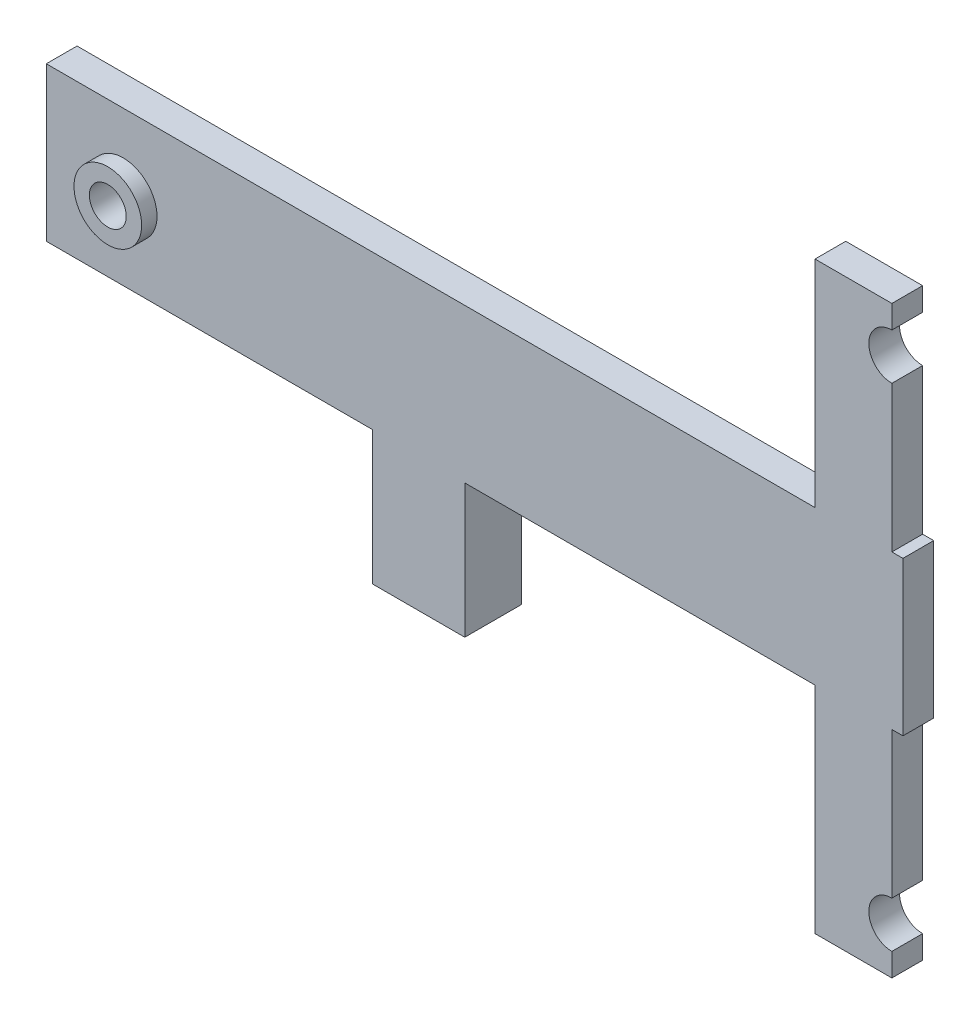
from build123d import *

# Parameters (mm, degrees)
SKETCH1_R                = 0.254
SKETCH1_R_2              = 1.2
BOSS_EXTRUDE1_DEPTH      = 1
SKETCH2_R                = 2.2
SKETCH2_R_2              = 1.2
BOSS_EXTRUDE2_DEPTH      = 2
BOSS_EXTRUDE3_DEPTH      = 1.7018
BOSS_EXTRUDE3_DEPTH_BACK = 2
SKETCH5_R                = 1
CUT_EXTRUDE3_DEPTH       = 2


with BuildPart() as part:
    # Sketch1 → Boss-Extrude1 (new, symmetric)
    with BuildSketch(Plane.XY):
        with BuildLine():
            Line((-5, 5), (-5, -5))
            Line((-5, -5), (45, -5))
            Line((45, -5), (45, -19))
            Line((45, -19), (50, -19))
            Line((50, -19), (50, -17.5))
            ThreePointArc((50, -17.5), (48.5, -16), (50, -14.5))
            Line((50, -14.5), (50, -5))
            Line((50, -5), (50.72, -5))
            Line((50.72, -5), (50.72, 0))
            Line((50.72, 0), (50.72, 5))
            Line((50.72, 5), (50, 5))
            Line((50, 5), (50, 14.5))
            ThreePointArc((50, 14.5), (48.5, 16), (50, 17.5))
            Line((50, 17.5), (50, 19))
            Line((50, 19), (45, 19))
            Line((45, 19), (45, 5))
            Line((45, 5), (-5, 5))
        make_face()
        with Locations((19.22, -2.25)):
            Circle(SKETCH1_R, mode=Mode.SUBTRACT)
        Circle(SKETCH1_R_2, mode=Mode.SUBTRACT)
    extrude(amount=BOSS_EXTRUDE1_DEPTH, both=True)

    # Sketch2 → Boss-Extrude2 (add, symmetric)
    with BuildSketch(Plane.XY):
        Circle(SKETCH2_R)
        Circle(SKETCH2_R_2, mode=Mode.SUBTRACT)
    extrude(amount=BOSS_EXTRUDE2_DEPTH, both=True)

    # Sketch3 → Boss-Extrude3 (add, two sides: drawn at the far end of the back side and taken through both)
    with BuildSketch(Plane(origin=(0, 0, -1), x_dir=(-1, 0, 0), z_dir=(0, 0, -1)).offset(-BOSS_EXTRUDE3_DEPTH_BACK)):
        Polygon((-19.22, -1.696), (-22.22, -1.696), (-22.22, -13.696), (-16.22, -13.696), (-16.22, -12.696), (-16.22, -11.696), (-16.22, -9.062), (-16.22, -1.696), align=None)
    extrude(amount=BOSS_EXTRUDE3_DEPTH + BOSS_EXTRUDE3_DEPTH_BACK)

    # Sketch5 → Cut-Extrude3 (cut)
    with BuildSketch(Plane(origin=(0, 0, -2.7018), x_dir=(-1, 0, 0), z_dir=(0, 0, -1))):
        with Locations((-19.22, -4.696)):
            Circle(SKETCH5_R)
    extrude(amount=-CUT_EXTRUDE3_DEPTH, mode=Mode.SUBTRACT)


solid = part.part
